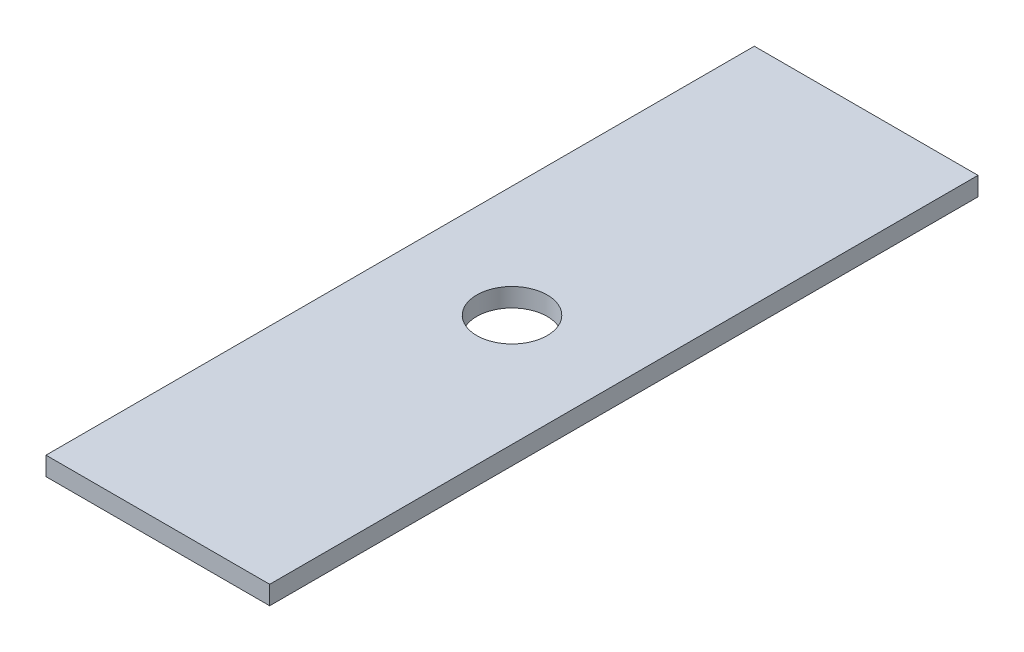
from build123d import *

# Parameters (mm, degrees)
BOSS_EXTRUDE1_DEPTH        = 60.325
BOSS_EXTRUDE1_DEPTH_BACK   = 60.325
SKETCH3_W                  = 38.1
SKETCH3_H                  = 3.175
F_12_0MM_DOWEL_HOLE1_D     = 12
F_12_0MM_DOWEL_HOLE1_DEPTH = 9.652
F_12_0MM_DOWEL_HOLE1_TIP   = 3.605163714


with BuildPart() as part:
    # Sketch3 → Boss-Extrude1 (new, two sides: drawn at the far end of the back side and taken through both)
    with BuildSketch(Plane.XY.offset(-BOSS_EXTRUDE1_DEPTH_BACK)):
        Rectangle(SKETCH3_W, SKETCH3_H)
    extrude(amount=BOSS_EXTRUDE1_DEPTH + BOSS_EXTRUDE1_DEPTH_BACK)

    # Ø12.0mm Dowel Hole1
    with Locations(Plane(origin=(0, 1.5875, 0), x_dir=(1, 0, 0), z_dir=(0, 1, 0))):
        with Locations((0, 0)):
            Hole(F_12_0MM_DOWEL_HOLE1_D / 2, depth=F_12_0MM_DOWEL_HOLE1_DEPTH)
            with Locations((0, 0, -(F_12_0MM_DOWEL_HOLE1_DEPTH + F_12_0MM_DOWEL_HOLE1_TIP / 2))):  # 118° drill point
                Cone(0, F_12_0MM_DOWEL_HOLE1_D / 2, F_12_0MM_DOWEL_HOLE1_TIP, mode=Mode.SUBTRACT)


solid = part.part
